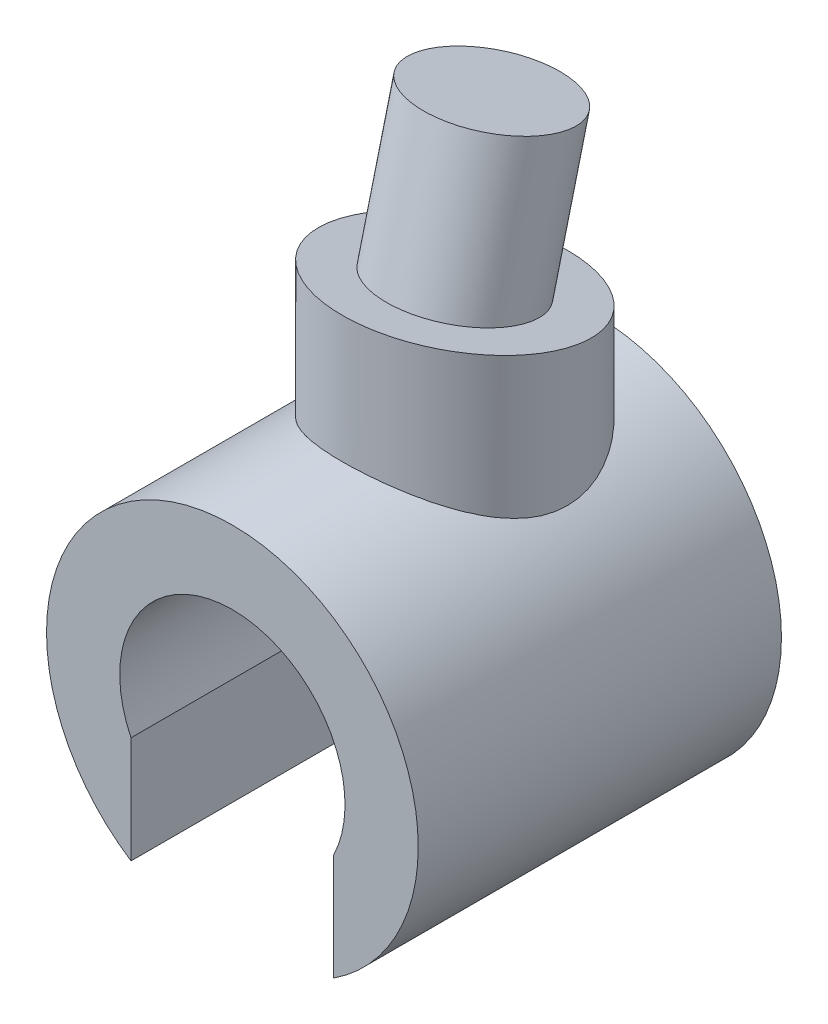
from build123d import *

# Parameters (mm, degrees)
SALIENTE_EXTRUIR1_DEPTH    = 6.45
CROQUIS4_W                 = 4
CROQUIS4_H                 = 6.803555247
CORTAR_EXTRUIR1_DEPTH      = 15.435113439
CORTAR_EXTRUIR1_DEPTH_BACK = 15.435113439
CROQUIS6_R                 = 2.5
SALIENTE_EXTRUIR2_DEPTH    = 5.4


with BuildPart() as part:
    # Croquis3 → Saliente-Extruir1 (new, symmetric)
    with BuildSketch(Plane.XY):
        with BuildLine():
            Line((-3.6, -1.743559577), (-3.6, -5.531726674))
            ThreePointArc((-3.6, -5.531726674), (0, 6.6), (3.6, -5.531726674))
            Line((3.6, -5.531726674), (3.6, -1.743559577))
            ThreePointArc((3.6, -1.743559577), (0, 4), (-3.6, -1.743559577))
        make_face()
    extrude(amount=SALIENTE_EXTRUIR1_DEPTH, both=True)


with BuildPart() as body_2:
    # Croquis4 → Revolución5 (revolve)
    with BuildSketch(Plane(origin=(0, 0, 0), x_dir=(0, 0, -1), z_dir=(1, 0, 0))):
        with Locations((3.45, 7.698222377)):
            Rectangle(CROQUIS4_W, CROQUIS4_H)
    revolve(axis=Axis((0, 4.296444753, -1.45), (0, 1, 0)))

    # Croquis5 → Cortar-Extruir1 (cut, two sides: drawn at the far end of the back side and taken through both)
    with BuildSketch(Plane(origin=(0, 0, 0), x_dir=(0, 0, -1), z_dir=(1, 0, 0)).offset(-CORTAR_EXTRUIR1_DEPTH_BACK)):
        Polygon((-2.55, 11.1), (5.45, 9.1), (5.45, 11.1), align=None)
    extrude(amount=CORTAR_EXTRUIR1_DEPTH + CORTAR_EXTRUIR1_DEPTH_BACK, mode=Mode.SUBTRACT)

    # Croquis6 → Saliente-Extruir2 (add)
    with BuildSketch(Plane(origin=(0, 9.847058824, -2.461764706), x_dir=(1, 0, 0), z_dir=(0, 0.9701425001453319, -0.24253562503633297))):
        with Locations(Location((0, -1.042903188, 0), (0, 0, 90))):
            Circle(CROQUIS6_R)
    extrude(amount=SALIENTE_EXTRUIR2_DEPTH)


solid = Compound([part.part, body_2.part])
